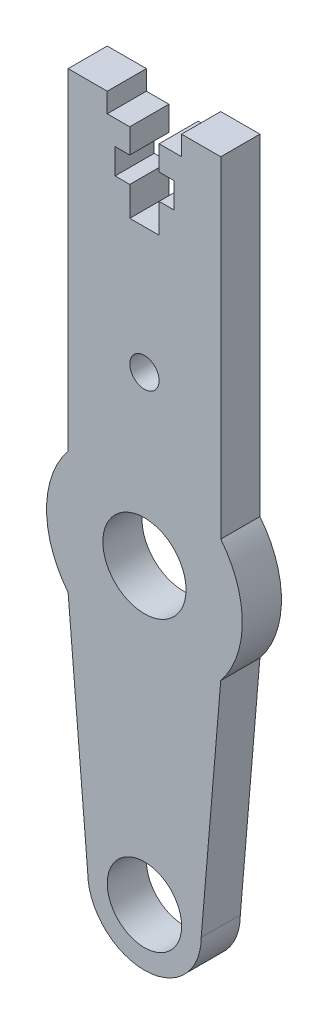
from build123d import *

# Parameters (mm, degrees)
SKETCH_1_R      = 4.25
SKETCH_1_R_2    = 3.8
SKETCH_1_R_3    = 1.5
EXTRUDE_1_DEPTH = 4


with BuildPart() as part:
    # 草图1 → 凸台-拉伸1 (new body)
    with BuildSketch(Plane.XY):
        with BuildLine():
            Line((1.497207067, 22.610079684), (3.797207067, 22.610079684))
            Line((3.797207067, 22.610079684), (3.797207067, 24.610079684))
            Line((3.797207067, 24.610079684), (7.797207067, 24.610079684))
            Line((7.797207067, 24.610079684), (7.797207067, -9.232125177))
            ThreePointArc((7.797207067, -9.232125177), (9.997207067, -15.489920316), (7.797207067, -21.747715455))
            Line((7.797207067, -21.747715455), (5.797207067, -45.489920316))
            ThreePointArc((5.797207067, -45.489920316), (-0.002792933, -51.289920316), (-5.802792933, -45.489920316))
            Line((-5.802792933, -45.489920316), (-7.802792933, -21.747715455))
            ThreePointArc((-7.802792933, -21.747715455), (-10.002792933, -15.489920316), (-7.802792933, -9.232125177))
            Line((-7.802792933, -9.232125177), (-7.802792933, 24.610079684))
            Line((-7.802792933, 24.610079684), (-3.802792933, 24.610079684))
            Line((-3.802792933, 24.610079684), (-3.802792933, 22.610079684))
            Line((-3.802792933, 22.610079684), (-1.502792933, 22.610079684))
            Line((-1.502792933, 22.610079684), (-1.502792933, 20.110079684))
            Line((-1.502792933, 20.110079684), (-3.002792933, 20.110079684))
            Line((-3.002792933, 20.110079684), (-3.002792933, 17.510079684))
            Line((-3.002792933, 17.510079684), (-1.502792933, 17.510079684))
            Line((-1.502792933, 17.510079684), (-1.502792933, 14.510079684))
            Line((-1.502792933, 14.510079684), (1.497207067, 14.510079684))
            Line((1.497207067, 14.510079684), (1.497207067, 17.510079684))
            Line((1.497207067, 17.510079684), (2.997207067, 17.510079684))
            Line((2.997207067, 17.510079684), (2.997207067, 20.110079684))
            Line((2.997207067, 20.110079684), (1.497207067, 20.110079684))
            Line((1.497207067, 20.110079684), (1.497207067, 22.610079684))
        make_face()
        with Locations((-0.002792933, -15.489920316)):
            Circle(SKETCH_1_R, mode=Mode.SUBTRACT)
        with Locations((-0.002792933, -45.489920316)):
            Circle(SKETCH_1_R_2, mode=Mode.SUBTRACT)
        with Locations((-0.002792933, 1.630079684)):
            Circle(SKETCH_1_R_3, mode=Mode.SUBTRACT)
    extrude(amount=EXTRUDE_1_DEPTH)


solid = part.part
